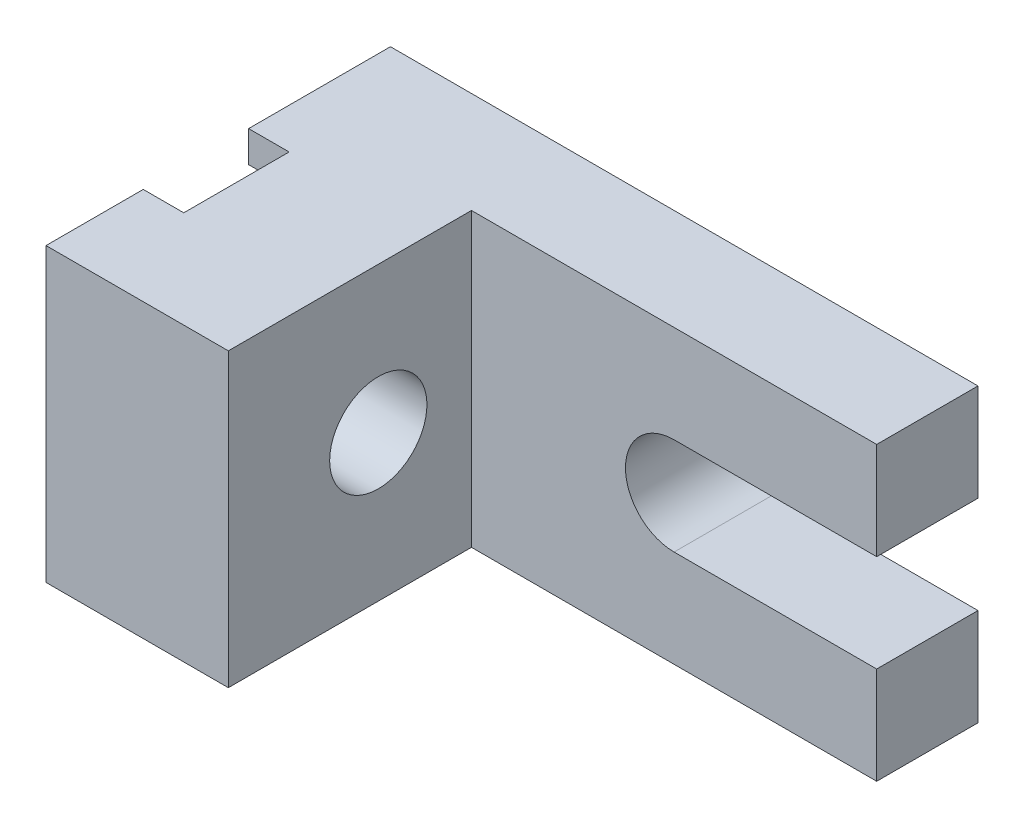
from build123d import *

# Parameters (mm, degrees)
SKETCH1_W           = 135
SKETCH1_H           = 72
BOSS_EXTRUDE2_DEPTH = 25
SKETCH2_W           = 60
SKETCH2_H           = 5
CUT_EXTRUDE1_DEPTH  = 72
CUT_EXTRUDE2_DEPTH  = 153
SKETCH4_W           = 30
SKETCH4_H           = 72
BOSS_EXTRUDE3_DEPTH = 10
SKETCH7_W           = 5
SKETCH7_H           = 22
BOSS_EXTRUDE4_DEPTH = 70
SKETCH9_W           = 35
SKETCH9_H           = 72
BOSS_EXTRUDE5_DEPTH = 60
SKETCH10_W          = 10
SKETCH10_H          = 24
BOSS_EXTRUDE6_DEPTH = 72
CUT_EXTRUDE3_DEPTH  = 10
SKETCH12_R          = 12
CUT_EXTRUDE4_DEPTH  = 42


with BuildPart() as part:
    # Sketch1 → Boss-Extrude2 (new body)
    with BuildSketch(Plane.XY):
        with Locations((67.5, -36)):
            Rectangle(SKETCH1_W, SKETCH1_H)
    extrude(amount=BOSS_EXTRUDE2_DEPTH)

    # Sketch2 → Cut-Extrude1 (cut)
    with BuildSketch(Plane.XZ.offset(72)):
        with Locations((30, 2.5)):
            Rectangle(SKETCH2_W, SKETCH2_H)
    extrude(amount=-CUT_EXTRUDE1_DEPTH, mode=Mode.SUBTRACT)

    # Sketch3 → Cut-Extrude2 (cut)
    with BuildSketch(Plane.XY):
        with BuildLine():
            Line((135, -24), (85, -24))
            ThreePointArc((85, -24), (73, -36), (85, -48))
            Line((85, -48), (135, -48))
            Line((135, -48), (135, -24))
        make_face()
    extrude(amount=CUT_EXTRUDE2_DEPTH, mode=Mode.SUBTRACT)

    # Sketch4 → Boss-Extrude3 (add)
    with BuildSketch(Plane.ZY):
        with Locations((20, -36)):
            Rectangle(SKETCH4_W, SKETCH4_H)
    extrude(amount=BOSS_EXTRUDE3_DEPTH)

    # Sketch7 → Boss-Extrude4 (add)
    with BuildSketch(Plane.ZY.offset(10)):
        with Locations((2.5, -11)):
            Rectangle(SKETCH7_W, SKETCH7_H)
    extrude(amount=-BOSS_EXTRUDE4_DEPTH)

    # Sketch9 → Boss-Extrude5 (add)
    with BuildSketch(Plane.XY.offset(25)):
        with Locations((17.5, -36)):
            Rectangle(SKETCH9_W, SKETCH9_H)
    extrude(amount=BOSS_EXTRUDE5_DEPTH)

    # Sketch10 → Boss-Extrude6 (add)
    with BuildSketch(Plane.XZ.offset(72)):
        with Locations((-5, 73)):
            Rectangle(SKETCH10_W, SKETCH10_H)
    extrude(amount=-BOSS_EXTRUDE6_DEPTH)

    # Sketch11 → Cut-Extrude3 (cut)
    with BuildSketch(Plane.ZY.offset(10)):
        with BuildLine():
            Line((35, -7.715728753), (35, -64.284271247))
            ThreePointArc((35, -64.284271247), (15, -36), (35, -7.715728753))
        make_face()
        with BuildLine():
            Line((61, -10.622844919), (61, -61.377155081))
            ThreePointArc((61, -61.377155081), (75, -36), (61, -10.622844919))
        make_face()
    extrude(amount=-CUT_EXTRUDE3_DEPTH, mode=Mode.SUBTRACT)

    # Sketch12 → Cut-Extrude4 (cut)
    with BuildSketch(Plane.ZY):
        with Locations((48, -36)):
            Circle(SKETCH12_R)
    extrude(amount=-CUT_EXTRUDE4_DEPTH, mode=Mode.SUBTRACT)


solid = part.part
